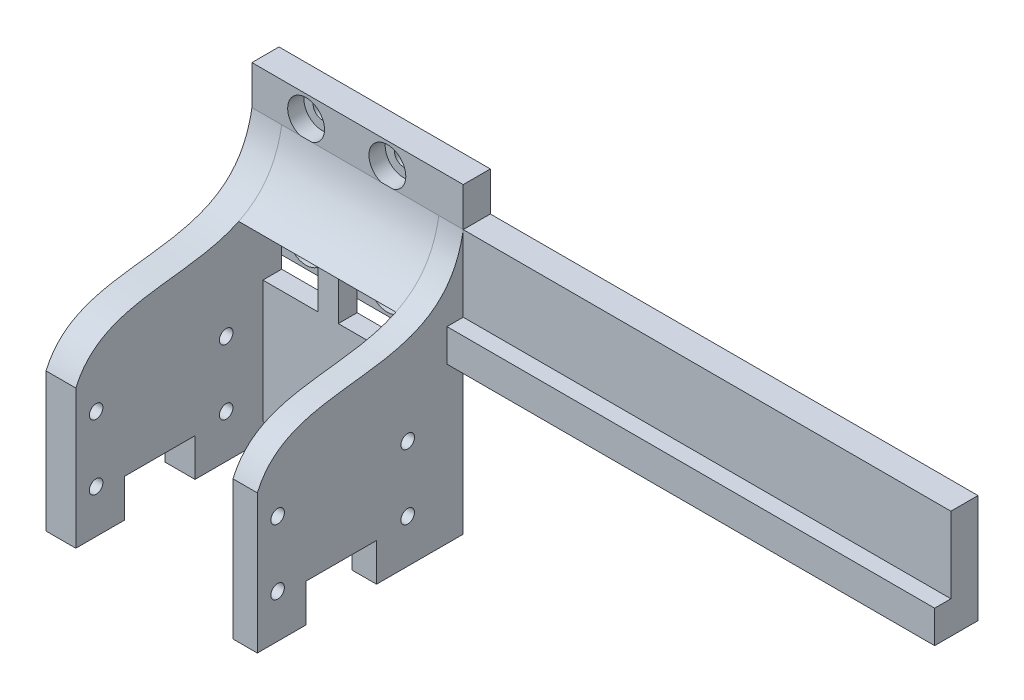
from build123d import *

# Parameters (mm, degrees)
BOSS_EXTRUDE1_DEPTH  = 5
SKETCH2_R            = 1.7
CUT_EXTRUDE1_DEPTH   = 5
SKETCH3_W            = 5.5
SKETCH3_H            = 45.88
SKETCH3_W_2          = 4.5
BOSS_EXTRUDE2_DEPTH  = 38
CUT_EXTRUDE2_REACH   = 149.725
SKETCH4_W            = 13
SKETCH4_H            = 7
SKETCH4_R            = 1.25
BOSS_EXTRUDE3_DEPTH  = 1
BOSS_EXTRUDE4_START  = -6
SKETCH7_W            = 90
SKETCH7_H            = 6
BOSS_EXTRUDE4_DEPTH  = 3
CUT_EXTRUDE4_START   = -7
CUT_EXTRUDE4_DEPTH   = 7
SKETCH9_R            = 3.4
CUT_EXTRUDE5_DEPTH   = 3
SKETCH10_W           = 4.789878221
SKETCH10_H           = 3.38
CUT_EXTRUDE8_DEPTH   = 1
SKETCH11_W           = 1.949149218
SKETCH11_H           = 7.867353861
CUT_EXTRUDE9_DEPTH   = 150
BOSS_EXTRUDE8_REACH  = 120.794
SKETCH12_W           = 3.475847807
SKETCH12_H           = 27.88
CUT_EXTRUDE10_REACH  = 149.725
SKETCH13_W           = 38
SKETCH13_H           = 20.273496977
BOSS_EXTRUDE9_DEPTH  = 5.5
BOSS_EXTRUDE10_START = -34.5
BOSS_EXTRUDE10_DEPTH = 4.5
BOSS_EXTRUDE11_REACH = 120.794
SKETCH16_W           = 3.200812403
SKETCH16_H           = 11.605139137
SKETCH16_W_2         = 3.702426982
SKETCH16_H_2         = 11.605139132
BOSS_EXTRUDE12_DEPTH = 3.475847807


with BuildPart() as part:
    # Sketch1 → Boss-Extrude1 (new body)
    with BuildSketch(Plane.XY):
        Polygon((-17.754674933, -9.049768579), (-17.754674933, -1.849768579), (-56.754674933, -1.849768579), (-56.754674933, -15.485645904), (-56.754674933, -29.849768579), (-17.754674933, -29.849768579), (-17.754674933, -29.049768579), (72.245325067, -29.049768579), (72.245325067, -9.049768579), align=None)
    extrude(amount=BOSS_EXTRUDE1_DEPTH)

    # Sketch2 → Cut-Extrude1 (cut)
    with BuildSketch(Plane.XY.offset(5)):
        with Locations((-46.754674933, -5.849768579)):
            Circle(SKETCH2_R)
        with Locations((-31.754674933, -5.849768579)):
            Circle(SKETCH2_R)
        with Locations((-31.754674933, -25.849768579)):
            Circle(SKETCH2_R)
        with Locations((-46.754674933, -25.849768579)):
            Circle(SKETCH2_R)
    extrude(amount=-CUT_EXTRUDE1_DEPTH, mode=Mode.SUBTRACT)

    # Sketch3 → Boss-Extrude2 (add)
    with BuildSketch(Plane.XY.offset(5)):
        with Locations((-54.004674933, -34.789768579)):
            Rectangle(SKETCH3_W, SKETCH3_H)
        with Locations((-20.004674933, -34.789768579)):
            Rectangle(SKETCH3_W_2, SKETCH3_H)
    extrude(amount=BOSS_EXTRUDE2_DEPTH)

    # Cut-Extrude2: up to this face of the body (flat: up to its plane)
    cut_extrude2_end = Plane(part.part.faces().sort_by_distance((-17.754674933, -34.777544983, 23.950785149))[0])
    # Sketch4 → Cut-Extrude2 (cut, up to the picked face)
    with BuildSketch(Plane.ZY.offset(56.754674933), mode=Mode.PRIVATE) as cut_extrude2_sk1:
        with Locations((27.5, -54.229768579)):
            Rectangle(SKETCH4_W, SKETCH4_H)
    cut_extrude2_tool1 = split(extrude(cut_extrude2_sk1.sketch, amount=-CUT_EXTRUDE2_REACH, mode=Mode.PRIVATE), bisect_by=cut_extrude2_end, keep=Keep.BOTH, mode=Mode.PRIVATE)
    # Sketch4 → Cut-Extrude2 (cut, up to the picked face)
    with BuildSketch(Plane.ZY.offset(56.754674933), mode=Mode.PRIVATE) as cut_extrude2_sk2:
        with Locations(Location((15.25, -37.729768579, 0), (0, 0, 270))):
            Circle(SKETCH4_R)
    cut_extrude2_tool2 = split(extrude(cut_extrude2_sk2.sketch, amount=-CUT_EXTRUDE2_REACH, mode=Mode.PRIVATE), bisect_by=cut_extrude2_end, keep=Keep.BOTH, mode=Mode.PRIVATE)
    # Sketch4 → Cut-Extrude2 (cut, up to the picked face)
    with BuildSketch(Plane.ZY.offset(56.754674933), mode=Mode.PRIVATE) as cut_extrude2_sk3:
        with Locations(Location((39.25, -37.729768579, 0), (0, 0, 270))):
            Circle(SKETCH4_R)
    cut_extrude2_tool3 = split(extrude(cut_extrude2_sk3.sketch, amount=-CUT_EXTRUDE2_REACH, mode=Mode.PRIVATE), bisect_by=cut_extrude2_end, keep=Keep.BOTH, mode=Mode.PRIVATE)
    # Sketch4 → Cut-Extrude2 (cut, up to the picked face)
    with BuildSketch(Plane.ZY.offset(56.754674933), mode=Mode.PRIVATE) as cut_extrude2_sk4:
        with Locations(Location((39.25, -49.729768579, 0), (0, 0, 270))):
            Circle(SKETCH4_R)
    cut_extrude2_tool4 = split(extrude(cut_extrude2_sk4.sketch, amount=-CUT_EXTRUDE2_REACH, mode=Mode.PRIVATE), bisect_by=cut_extrude2_end, keep=Keep.BOTH, mode=Mode.PRIVATE)
    # Sketch4 → Cut-Extrude2 (cut, up to the picked face)
    with BuildSketch(Plane.ZY.offset(56.754674933), mode=Mode.PRIVATE) as cut_extrude2_sk5:
        with Locations(Location((15.25, -49.729768579, 0), (0, 0, 270))):
            Circle(SKETCH4_R)
    cut_extrude2_tool5 = split(extrude(cut_extrude2_sk5.sketch, amount=-CUT_EXTRUDE2_REACH, mode=Mode.PRIVATE), bisect_by=cut_extrude2_end, keep=Keep.BOTH, mode=Mode.PRIVATE)
    add(cut_extrude2_tool1.solids().sort_by(Axis((-56.754675, -54.229769, 27.5), (1, 0, 0)))[0], mode=Mode.SUBTRACT)
    add(cut_extrude2_tool2.solids().sort_by(Axis((-56.754675, -37.729769, 15.25), (1, 0, 0)))[0], mode=Mode.SUBTRACT)
    add(cut_extrude2_tool3.solids().sort_by(Axis((-56.754675, -37.729769, 39.25), (1, 0, 0)))[0], mode=Mode.SUBTRACT)
    add(cut_extrude2_tool4.solids().sort_by(Axis((-56.754675, -49.729769, 39.25), (1, 0, 0)))[0], mode=Mode.SUBTRACT)
    add(cut_extrude2_tool5.solids().sort_by(Axis((-56.754675, -49.729769, 15.25), (1, 0, 0)))[0], mode=Mode.SUBTRACT)

    # Sketch5 → Boss-Extrude3 (add)
    with BuildSketch(Plane(origin=(0, 0, 0), x_dir=(-1, 0, 0), z_dir=(0, 0, -1))):
        with BuildLine():
            Line((-72.245325067, -26.669768579), (-71.800325067, -26.669768579))
            Line((-71.800325067, -26.669768579), (-70.984367777, -28.911592809))
            ThreePointArc((-70.984367777, -28.911592809), (-70.907483378, -29.011790508), (-70.787032326, -29.049768579))
            Line((-70.787032326, -29.049768579), (-70.377032326, -29.049768579))
            ThreePointArc((-70.377032326, -29.049768579), (-70.256581275, -29.011790508), (-70.179696876, -28.911592809))
            Line((-70.179696876, -28.911592809), (-69.363739586, -26.669768579))
            Line((-69.363739586, -26.669768579), (-68.473739586, -26.669768579))
            Line((-68.473739586, -26.669768579), (-67.657782296, -28.911592809))
            ThreePointArc((-67.657782296, -28.911592809), (-67.580897897, -29.011790508), (-67.460446845, -29.049768579))
            Line((-67.460446845, -29.049768579), (-67.050446845, -29.049768579))
            ThreePointArc((-67.050446845, -29.049768579), (-66.929995794, -29.011790508), (-66.853111395, -28.911592809))
            Line((-66.853111395, -28.911592809), (-66.037154105, -26.669768579))
            Line((-66.037154105, -26.669768579), (-65.140325067, -26.669768579))
            Line((-65.140325067, -26.669768579), (-64.324367777, -28.911592809))
            ThreePointArc((-64.324367777, -28.911592809), (-64.247483378, -29.011790508), (-64.127032326, -29.049768579))
            Line((-64.127032326, -29.049768579), (-63.717032326, -29.049768579))
            ThreePointArc((-63.717032326, -29.049768579), (-63.596581275, -29.011790508), (-63.519696876, -28.911592809))
            Line((-63.519696876, -28.911592809), (-62.703739586, -26.669768579))
            Line((-62.703739586, -26.669768579), (-61.813739586, -26.669768579))
            Line((-61.813739586, -26.669768579), (-60.997782296, -28.911592809))
            ThreePointArc((-60.997782296, -28.911592809), (-60.920897897, -29.011790508), (-60.800446845, -29.049768579))
            Line((-60.800446845, -29.049768579), (-60.390446845, -29.049768579))
            ThreePointArc((-60.390446845, -29.049768579), (-60.269995794, -29.011790508), (-60.193111395, -28.911592809))
            Line((-60.193111395, -28.911592809), (-59.377154105, -26.669768579))
            Line((-59.377154105, -26.669768579), (-58.480325067, -26.669768579))
            Line((-58.480325067, -26.669768579), (-57.664367777, -28.911592809))
            ThreePointArc((-57.664367777, -28.911592809), (-57.587483378, -29.011790508), (-57.467032326, -29.049768579))
            Line((-57.467032326, -29.049768579), (-57.057032326, -29.049768579))
            ThreePointArc((-57.057032326, -29.049768579), (-56.936581275, -29.011790508), (-56.859696876, -28.911592809))
            Line((-56.859696876, -28.911592809), (-56.043739586, -26.669768579))
            Line((-56.043739586, -26.669768579), (-55.153739586, -26.669768579))
            Line((-55.153739586, -26.669768579), (-54.337782296, -28.911592809))
            ThreePointArc((-54.337782296, -28.911592809), (-54.260897897, -29.011790508), (-54.140446845, -29.049768579))
            Line((-54.140446845, -29.049768579), (-53.730446845, -29.049768579))
            ThreePointArc((-53.730446845, -29.049768579), (-53.609995794, -29.011790508), (-53.533111395, -28.911592809))
            Line((-53.533111395, -28.911592809), (-52.717154105, -26.669768579))
            Line((-52.717154105, -26.669768579), (-51.820325067, -26.669768579))
            Line((-51.820325067, -26.669768579), (-51.004367777, -28.911592809))
            ThreePointArc((-51.004367777, -28.911592809), (-50.927483378, -29.011790508), (-50.807032326, -29.049768579))
            Line((-50.807032326, -29.049768579), (-50.397032326, -29.049768579))
            ThreePointArc((-50.397032326, -29.049768579), (-50.276581275, -29.011790508), (-50.199696876, -28.911592809))
            Line((-50.199696876, -28.911592809), (-49.383739586, -26.669768579))
            Line((-49.383739586, -26.669768579), (-48.493739586, -26.669768579))
            Line((-48.493739586, -26.669768579), (-47.677782296, -28.911592809))
            ThreePointArc((-47.677782296, -28.911592809), (-47.600897897, -29.011790508), (-47.480446845, -29.049768579))
            Line((-47.480446845, -29.049768579), (-47.070446845, -29.049768579))
            ThreePointArc((-47.070446845, -29.049768579), (-46.949995794, -29.011790508), (-46.873111395, -28.911592809))
            Line((-46.873111395, -28.911592809), (-46.057154105, -26.669768579))
            Line((-46.057154105, -26.669768579), (-45.160325067, -26.669768579))
            Line((-45.160325067, -26.669768579), (-44.344367777, -28.911592809))
            ThreePointArc((-44.344367777, -28.911592809), (-44.267483378, -29.011790508), (-44.147032326, -29.049768579))
            Line((-44.147032326, -29.049768579), (-43.737032326, -29.049768579))
            ThreePointArc((-43.737032326, -29.049768579), (-43.616581275, -29.011790508), (-43.539696876, -28.911592809))
            Line((-43.539696876, -28.911592809), (-42.723739586, -26.669768579))
            Line((-42.723739586, -26.669768579), (-41.833739586, -26.669768579))
            Line((-41.833739586, -26.669768579), (-41.017782296, -28.911592809))
            ThreePointArc((-41.017782296, -28.911592809), (-40.940897897, -29.011790508), (-40.820446845, -29.049768579))
            Line((-40.820446845, -29.049768579), (-40.410446845, -29.049768579))
            ThreePointArc((-40.410446845, -29.049768579), (-40.289995794, -29.011790508), (-40.213111395, -28.911592809))
            Line((-40.213111395, -28.911592809), (-39.397154105, -26.669768579))
            Line((-39.397154105, -26.669768579), (-38.500325067, -26.669768579))
            Line((-38.500325067, -26.669768579), (-37.684367777, -28.911592809))
            ThreePointArc((-37.684367777, -28.911592809), (-37.607483378, -29.011790508), (-37.487032326, -29.049768579))
            Line((-37.487032326, -29.049768579), (-37.077032326, -29.049768579))
            ThreePointArc((-37.077032326, -29.049768579), (-36.956581275, -29.011790508), (-36.879696876, -28.911592809))
            Line((-36.879696876, -28.911592809), (-36.063739586, -26.669768579))
            Line((-36.063739586, -26.669768579), (-35.173739586, -26.669768579))
            Line((-35.173739586, -26.669768579), (-34.357782296, -28.911592809))
            ThreePointArc((-34.357782296, -28.911592809), (-34.280897897, -29.011790508), (-34.160446845, -29.049768579))
            Line((-34.160446845, -29.049768579), (-33.750446845, -29.049768579))
            ThreePointArc((-33.750446845, -29.049768579), (-33.629995794, -29.011790508), (-33.553111395, -28.911592809))
            Line((-33.553111395, -28.911592809), (-32.737154105, -26.669768579))
            Line((-32.737154105, -26.669768579), (-31.840325067, -26.669768579))
            Line((-31.840325067, -26.669768579), (-31.024367777, -28.911592809))
            ThreePointArc((-31.024367777, -28.911592809), (-30.947483378, -29.011790508), (-30.827032326, -29.049768579))
            Line((-30.827032326, -29.049768579), (-30.417032326, -29.049768579))
            ThreePointArc((-30.417032326, -29.049768579), (-30.296581275, -29.011790508), (-30.219696876, -28.911592809))
            Line((-30.219696876, -28.911592809), (-29.403739586, -26.669768579))
            Line((-29.403739586, -26.669768579), (-28.513739586, -26.669768579))
            Line((-28.513739586, -26.669768579), (-27.697782296, -28.911592809))
            ThreePointArc((-27.697782296, -28.911592809), (-27.620897897, -29.011790508), (-27.500446845, -29.049768579))
            Line((-27.500446845, -29.049768579), (-27.090446845, -29.049768579))
            ThreePointArc((-27.090446845, -29.049768579), (-26.969995794, -29.011790508), (-26.893111395, -28.911592809))
            Line((-26.893111395, -28.911592809), (-26.077154105, -26.669768579))
            Line((-26.077154105, -26.669768579), (-25.180325067, -26.669768579))
            Line((-25.180325067, -26.669768579), (-24.364367777, -28.911592809))
            ThreePointArc((-24.364367777, -28.911592809), (-24.287483378, -29.011790508), (-24.167032326, -29.049768579))
            Line((-24.167032326, -29.049768579), (-23.757032326, -29.049768579))
            ThreePointArc((-23.757032326, -29.049768579), (-23.636581275, -29.011790508), (-23.559696876, -28.911592809))
            Line((-23.559696876, -28.911592809), (-22.743739586, -26.669768579))
            Line((-22.743739586, -26.669768579), (-21.853739586, -26.669768579))
            Line((-21.853739586, -26.669768579), (-21.037782296, -28.911592809))
            ThreePointArc((-21.037782296, -28.911592809), (-20.960897897, -29.011790508), (-20.840446845, -29.049768579))
            Line((-20.840446845, -29.049768579), (-20.430446845, -29.049768579))
            ThreePointArc((-20.430446845, -29.049768579), (-20.309995794, -29.011790508), (-20.233111395, -28.911592809))
            Line((-20.233111395, -28.911592809), (-19.417154105, -26.669768579))
            Line((-19.417154105, -26.669768579), (-18.520325067, -26.669768579))
            Line((-18.520325067, -26.669768579), (-17.704367777, -28.911592809))
            ThreePointArc((-17.704367777, -28.911592809), (-17.627483378, -29.011790508), (-17.507032326, -29.049768579))
            Line((-17.507032326, -29.049768579), (-17.097032326, -29.049768579))
            ThreePointArc((-17.097032326, -29.049768579), (-16.976581275, -29.011790508), (-16.899696876, -28.911592809))
            Line((-16.899696876, -28.911592809), (-16.083739586, -26.669768579))
            Line((-16.083739586, -26.669768579), (-15.193739586, -26.669768579))
            Line((-15.193739586, -26.669768579), (-14.377782296, -28.911592809))
            ThreePointArc((-14.377782296, -28.911592809), (-14.300897897, -29.011790508), (-14.180446845, -29.049768579))
            Line((-14.180446845, -29.049768579), (-13.770446845, -29.049768579))
            ThreePointArc((-13.770446845, -29.049768579), (-13.649995794, -29.011790508), (-13.573111395, -28.911592809))
            Line((-13.573111395, -28.911592809), (-12.757154105, -26.669768579))
            Line((-12.757154105, -26.669768579), (-11.860325067, -26.669768579))
            Line((-11.860325067, -26.669768579), (-11.044367777, -28.911592809))
            ThreePointArc((-11.044367777, -28.911592809), (-10.967483378, -29.011790508), (-10.847032326, -29.049768579))
            Line((-10.847032326, -29.049768579), (-10.437032326, -29.049768579))
            ThreePointArc((-10.437032326, -29.049768579), (-10.316581275, -29.011790508), (-10.239696876, -28.911592809))
            Line((-10.239696876, -28.911592809), (-9.423739586, -26.669768579))
            Line((-9.423739586, -26.669768579), (-8.533739586, -26.669768579))
            Line((-8.533739586, -26.669768579), (-7.717782296, -28.911592809))
            ThreePointArc((-7.717782296, -28.911592809), (-7.640897897, -29.011790508), (-7.520446845, -29.049768579))
            Line((-7.520446845, -29.049768579), (-7.110446845, -29.049768579))
            ThreePointArc((-7.110446845, -29.049768579), (-6.989995794, -29.011790508), (-6.913111395, -28.911592809))
            Line((-6.913111395, -28.911592809), (-6.097154105, -26.669768579))
            Line((-6.097154105, -26.669768579), (-5.647154105, -26.669768579))
            Line((-5.647154105, -26.669768579), (-5.647154105, -25.669768579))
            Line((-5.647154105, -25.669768579), (-72.245325067, -25.669768579))
            Line((-72.245325067, -25.669768579), (-72.245325067, -26.669768579))
        make_face()
    extrude(amount=BOSS_EXTRUDE3_DEPTH)

    # Sketch7 → Boss-Extrude4 (add)
    with BuildSketch(Plane(origin=(0, 0, -1), x_dir=(-1, 0, 0), z_dir=(0, 0, -1)).offset(BOSS_EXTRUDE4_START)):
        with Locations((-27.245325067, -26.049768579)):
            Rectangle(SKETCH7_W, SKETCH7_H)
    extrude(amount=-BOSS_EXTRUDE4_DEPTH)

    # Sketch8 → Cut-Extrude4 (cut)
    with BuildSketch(Plane(origin=(0, 0, -1), x_dir=(-1, 0, 0), z_dir=(0, 0, -1)).offset(CUT_EXTRUDE4_START)):
        with BuildLine():
            ThreePointArc((-7.717782296, -28.911592809), (-7.640897897, -29.011790508), (-7.520446845, -29.049768579))
            Line((-7.520446845, -29.049768579), (-10.437032326, -29.049768579))
            ThreePointArc((-10.437032326, -29.049768579), (-10.316581275, -29.011790508), (-10.239696876, -28.911592809))
            Line((-10.239696876, -28.911592809), (-9.423739586, -26.669768579))
            Line((-9.423739586, -26.669768579), (-8.533739586, -26.669768579))
            Line((-8.533739586, -26.669768579), (-7.717782296, -28.911592809))
        make_face()
        with BuildLine():
            ThreePointArc((-4.387782296, -28.911592809), (-4.310897897, -29.011790508), (-4.190446845, -29.049768579))
            Line((-4.190446845, -29.049768579), (-7.107032326, -29.049768579))
            ThreePointArc((-7.107032326, -29.049768579), (-6.986581275, -29.011790508), (-6.909696876, -28.911592809))
            Line((-6.909696876, -28.911592809), (-6.093739586, -26.669768579))
            Line((-6.093739586, -26.669768579), (-5.203739586, -26.669768579))
            Line((-5.203739586, -26.669768579), (-4.387782296, -28.911592809))
        make_face()
        with BuildLine():
            ThreePointArc((-1.057782296, -28.911592809), (-0.980897897, -29.011790508), (-0.860446845, -29.049768579))
            Line((-0.860446845, -29.049768579), (-3.777032326, -29.049768579))
            ThreePointArc((-3.777032326, -29.049768579), (-3.656581275, -29.011790508), (-3.579696876, -28.911592809))
            Line((-3.579696876, -28.911592809), (-2.763739586, -26.669768579))
            Line((-2.763739586, -26.669768579), (-1.873739586, -26.669768579))
            Line((-1.873739586, -26.669768579), (-1.057782296, -28.911592809))
        make_face()
        with BuildLine():
            ThreePointArc((2.272217704, -28.911592809), (2.349102103, -29.011790508), (2.469553155, -29.049768579))
            Line((2.469553155, -29.049768579), (-0.447032326, -29.049768579))
            ThreePointArc((-0.447032326, -29.049768579), (-0.326581275, -29.011790508), (-0.249696876, -28.911592809))
            Line((-0.249696876, -28.911592809), (0.566260414, -26.669768579))
            Line((0.566260414, -26.669768579), (1.456260414, -26.669768579))
            Line((1.456260414, -26.669768579), (2.272217704, -28.911592809))
        make_face()
        with BuildLine():
            ThreePointArc((5.602217704, -28.911592809), (5.679102103, -29.011790508), (5.799553155, -29.049768579))
            Line((5.799553155, -29.049768579), (2.882967674, -29.049768579))
            ThreePointArc((2.882967674, -29.049768579), (3.003418725, -29.011790508), (3.080303124, -28.911592809))
            Line((3.080303124, -28.911592809), (3.896260414, -26.669768579))
            Line((3.896260414, -26.669768579), (4.786260414, -26.669768579))
            Line((4.786260414, -26.669768579), (5.602217704, -28.911592809))
        make_face()
        with BuildLine():
            ThreePointArc((8.932217704, -28.911592809), (9.009102103, -29.011790508), (9.129553155, -29.049768579))
            Line((9.129553155, -29.049768579), (6.212967674, -29.049768579))
            ThreePointArc((6.212967674, -29.049768579), (6.333418725, -29.011790508), (6.410303124, -28.911592809))
            Line((6.410303124, -28.911592809), (7.226260414, -26.669768579))
            Line((7.226260414, -26.669768579), (8.116260414, -26.669768579))
            Line((8.116260414, -26.669768579), (8.932217704, -28.911592809))
        make_face()
        with BuildLine():
            ThreePointArc((12.262217704, -28.911592809), (12.339102103, -29.011790508), (12.459553155, -29.049768579))
            Line((12.459553155, -29.049768579), (9.542967674, -29.049768579))
            ThreePointArc((9.542967674, -29.049768579), (9.663418725, -29.011790508), (9.740303124, -28.911592809))
            Line((9.740303124, -28.911592809), (10.556260414, -26.669768579))
            Line((10.556260414, -26.669768579), (11.446260414, -26.669768579))
            Line((11.446260414, -26.669768579), (12.262217704, -28.911592809))
        make_face()
        with BuildLine():
            ThreePointArc((15.592217704, -28.911592809), (15.669102103, -29.011790508), (15.789553155, -29.049768579))
            Line((15.789553155, -29.049768579), (12.872967674, -29.049768579))
            ThreePointArc((12.872967674, -29.049768579), (12.993418725, -29.011790508), (13.070303124, -28.911592809))
            Line((13.070303124, -28.911592809), (13.886260414, -26.669768579))
            Line((13.886260414, -26.669768579), (14.776260414, -26.669768579))
            Line((14.776260414, -26.669768579), (15.592217704, -28.911592809))
        make_face()
        with BuildLine():
            ThreePointArc((-63.717032326, -29.049768579), (-63.596581275, -29.011790508), (-63.519696876, -28.911592809))
            Line((-63.519696876, -28.911592809), (-62.703739586, -26.669768579))
            Line((-62.703739586, -26.669768579), (-61.813739586, -26.669768579))
            Line((-61.813739586, -26.669768579), (-60.997782296, -28.911592809))
            ThreePointArc((-60.997782296, -28.911592809), (-60.920897897, -29.011790508), (-60.800446845, -29.049768579))
            Line((-60.800446845, -29.049768579), (-63.717032326, -29.049768579))
        make_face()
        with BuildLine():
            ThreePointArc((-60.390446845, -29.049768579), (-60.269995794, -29.011790508), (-60.193111395, -28.911592809))
            Line((-60.193111395, -28.911592809), (-59.377154105, -26.669768579))
            Line((-59.377154105, -26.669768579), (-58.480325067, -26.669768579))
            Line((-58.480325067, -26.669768579), (-57.664367777, -28.911592809))
            ThreePointArc((-57.664367777, -28.911592809), (-57.587483378, -29.011790508), (-57.467032326, -29.049768579))
            Line((-57.467032326, -29.049768579), (-60.390446845, -29.049768579))
        make_face()
        with BuildLine():
            ThreePointArc((-57.057032326, -29.049768579), (-56.936581275, -29.011790508), (-56.859696876, -28.911592809))
            Line((-56.859696876, -28.911592809), (-56.043739586, -26.669768579))
            Line((-56.043739586, -26.669768579), (-55.153739586, -26.669768579))
            Line((-55.153739586, -26.669768579), (-54.337782296, -28.911592809))
            ThreePointArc((-54.337782296, -28.911592809), (-54.260897897, -29.011790508), (-54.140446845, -29.049768579))
            Line((-54.140446845, -29.049768579), (-57.057032326, -29.049768579))
        make_face()
        with BuildLine():
            ThreePointArc((-50.397032326, -29.049768579), (-50.276581275, -29.011790508), (-50.199696876, -28.911592809))
            Line((-50.199696876, -28.911592809), (-49.383739586, -26.669768579))
            Line((-49.383739586, -26.669768579), (-48.493739586, -26.669768579))
            Line((-48.493739586, -26.669768579), (-47.677782296, -28.911592809))
            ThreePointArc((-47.677782296, -28.911592809), (-47.600897897, -29.011790508), (-47.480446845, -29.049768579))
            Line((-47.480446845, -29.049768579), (-50.397032326, -29.049768579))
        make_face()
        with BuildLine():
            ThreePointArc((-53.730446845, -29.049768579), (-53.609995794, -29.011790508), (-53.533111395, -28.911592809))
            Line((-53.533111395, -28.911592809), (-52.717154105, -26.669768579))
            Line((-52.717154105, -26.669768579), (-51.820325067, -26.669768579))
            Line((-51.820325067, -26.669768579), (-51.004367777, -28.911592809))
            ThreePointArc((-51.004367777, -28.911592809), (-50.927483378, -29.011790508), (-50.807032326, -29.049768579))
            Line((-50.807032326, -29.049768579), (-53.730446845, -29.049768579))
        make_face()
        with BuildLine():
            ThreePointArc((-47.070446845, -29.049768579), (-46.949995794, -29.011790508), (-46.873111395, -28.911592809))
            Line((-46.873111395, -28.911592809), (-46.057154105, -26.669768579))
            Line((-46.057154105, -26.669768579), (-45.160325067, -26.669768579))
            Line((-45.160325067, -26.669768579), (-44.344367777, -28.911592809))
            ThreePointArc((-44.344367777, -28.911592809), (-44.267483378, -29.011790508), (-44.147032326, -29.049768579))
            Line((-44.147032326, -29.049768579), (-47.070446845, -29.049768579))
        make_face()
        with BuildLine():
            ThreePointArc((-43.737032326, -29.049768579), (-43.616581275, -29.011790508), (-43.539696876, -28.911592809))
            Line((-43.539696876, -28.911592809), (-42.723739586, -26.669768579))
            Line((-42.723739586, -26.669768579), (-41.833739586, -26.669768579))
            Line((-41.833739586, -26.669768579), (-41.017782296, -28.911592809))
            ThreePointArc((-41.017782296, -28.911592809), (-40.940897897, -29.011790508), (-40.820446845, -29.049768579))
            Line((-40.820446845, -29.049768579), (-43.737032326, -29.049768579))
        make_face()
        with BuildLine():
            ThreePointArc((-40.410446845, -29.049768579), (-40.289995794, -29.011790508), (-40.213111395, -28.911592809))
            Line((-40.213111395, -28.911592809), (-39.397154105, -26.669768579))
            Line((-39.397154105, -26.669768579), (-38.500325067, -26.669768579))
            Line((-38.500325067, -26.669768579), (-37.684367777, -28.911592809))
            ThreePointArc((-37.684367777, -28.911592809), (-37.607483378, -29.011790508), (-37.487032326, -29.049768579))
            Line((-37.487032326, -29.049768579), (-40.410446845, -29.049768579))
        make_face()
        with BuildLine():
            ThreePointArc((-37.077032326, -29.049768579), (-36.956581275, -29.011790508), (-36.879696876, -28.911592809))
            Line((-36.879696876, -28.911592809), (-36.063739586, -26.669768579))
            Line((-36.063739586, -26.669768579), (-35.173739586, -26.669768579))
            Line((-35.173739586, -26.669768579), (-34.357782296, -28.911592809))
            ThreePointArc((-34.357782296, -28.911592809), (-34.280897897, -29.011790508), (-34.160446845, -29.049768579))
            Line((-34.160446845, -29.049768579), (-37.077032326, -29.049768579))
        make_face()
        with BuildLine():
            ThreePointArc((-33.750446845, -29.049768579), (-33.629995794, -29.011790508), (-33.553111395, -28.911592809))
            Line((-33.553111395, -28.911592809), (-32.737154105, -26.669768579))
            Line((-32.737154105, -26.669768579), (-31.840325067, -26.669768579))
            Line((-31.840325067, -26.669768579), (-31.024367777, -28.911592809))
            ThreePointArc((-31.024367777, -28.911592809), (-30.947483378, -29.011790508), (-30.827032326, -29.049768579))
            Line((-30.827032326, -29.049768579), (-33.750446845, -29.049768579))
        make_face()
        with BuildLine():
            ThreePointArc((-30.417032326, -29.049768579), (-30.296581275, -29.011790508), (-30.219696876, -28.911592809))
            Line((-30.219696876, -28.911592809), (-29.403739586, -26.669768579))
            Line((-29.403739586, -26.669768579), (-28.513739586, -26.669768579))
            Line((-28.513739586, -26.669768579), (-27.697782296, -28.911592809))
            ThreePointArc((-27.697782296, -28.911592809), (-27.620897897, -29.011790508), (-27.500446845, -29.049768579))
            Line((-27.500446845, -29.049768579), (-30.417032326, -29.049768579))
        make_face()
        with BuildLine():
            ThreePointArc((-27.090446845, -29.049768579), (-26.969995794, -29.011790508), (-26.893111395, -28.911592809))
            Line((-26.893111395, -28.911592809), (-26.077154105, -26.669768579))
            Line((-26.077154105, -26.669768579), (-25.180325067, -26.669768579))
            Line((-25.180325067, -26.669768579), (-24.364367777, -28.911592809))
            ThreePointArc((-24.364367777, -28.911592809), (-24.287483378, -29.011790508), (-24.167032326, -29.049768579))
            Line((-24.167032326, -29.049768579), (-27.090446845, -29.049768579))
        make_face()
        with BuildLine():
            ThreePointArc((-23.757032326, -29.049768579), (-23.636581275, -29.011790508), (-23.559696876, -28.911592809))
            Line((-23.559696876, -28.911592809), (-22.743739586, -26.669768579))
            Line((-22.743739586, -26.669768579), (-21.853739586, -26.669768579))
            Line((-21.853739586, -26.669768579), (-21.037782296, -28.911592809))
            ThreePointArc((-21.037782296, -28.911592809), (-20.960897897, -29.011790508), (-20.840446845, -29.049768579))
            Line((-20.840446845, -29.049768579), (-23.757032326, -29.049768579))
        make_face()
        with BuildLine():
            ThreePointArc((-20.430446845, -29.049768579), (-20.309995794, -29.011790508), (-20.233111395, -28.911592809))
            Line((-20.233111395, -28.911592809), (-19.417154105, -26.669768579))
            Line((-19.417154105, -26.669768579), (-18.520325067, -26.669768579))
            Line((-18.520325067, -26.669768579), (-17.704367777, -28.911592809))
            ThreePointArc((-17.704367777, -28.911592809), (-17.627483378, -29.011790508), (-17.507032326, -29.049768579))
            Line((-17.507032326, -29.049768579), (-20.430446845, -29.049768579))
        make_face()
        with BuildLine():
            ThreePointArc((-17.097032326, -29.049768579), (-16.976581275, -29.011790508), (-16.899696876, -28.911592809))
            Line((-16.899696876, -28.911592809), (-16.083739586, -26.669768579))
            Line((-16.083739586, -26.669768579), (-15.193739586, -26.669768579))
            Line((-15.193739586, -26.669768579), (-14.377782296, -28.911592809))
            ThreePointArc((-14.377782296, -28.911592809), (-14.300897897, -29.011790508), (-14.180446845, -29.049768579))
            Line((-14.180446845, -29.049768579), (-17.097032326, -29.049768579))
        make_face()
        with BuildLine():
            ThreePointArc((-13.770446845, -29.049768579), (-13.649995794, -29.011790508), (-13.573111395, -28.911592809))
            Line((-13.573111395, -28.911592809), (-12.757154105, -26.669768579))
            Line((-12.757154105, -26.669768579), (-11.860325067, -26.669768579))
            Line((-11.860325067, -26.669768579), (-11.044367777, -28.911592809))
            ThreePointArc((-11.044367777, -28.911592809), (-10.967483378, -29.011790508), (-10.847032326, -29.049768579))
            Line((-10.847032326, -29.049768579), (-13.770446845, -29.049768579))
        make_face()
    extrude(amount=CUT_EXTRUDE4_DEPTH, mode=Mode.SUBTRACT)

    # Sketch9 → Cut-Extrude5 (cut)
    with BuildSketch(Plane.XY.offset(5)):
        with Locations((-46.754674933, -5.849768579)):
            Circle(SKETCH9_R)
        with Locations((-31.754674933, -5.849768579)):
            Circle(SKETCH9_R)
        with Locations((-31.754674933, -25.849768579)):
            Circle(SKETCH9_R)
        with Locations((-46.754674933, -25.849768579)):
            Circle(SKETCH9_R)
    extrude(amount=-CUT_EXTRUDE5_DEPTH, mode=Mode.SUBTRACT)

    # Sketch10 → Cut-Extrude8 (cut)
    with BuildSketch(Plane(origin=(0, 0, -1), x_dir=(-1, 0, 0), z_dir=(0, 0, -1))):
        with Locations((-8.042093215, -27.359768579)):
            Rectangle(SKETCH10_W, SKETCH10_H)
    extrude(amount=-CUT_EXTRUDE8_DEPTH, mode=Mode.SUBTRACT)

    # Sketch11 → Cut-Extrude9 (cut)
    with BuildSketch(Plane(origin=(72.245325067, 0, 0), x_dir=(0, 0, -1), z_dir=(1, 0, 0))):
        with Locations((0.974574609, -26.433113521)):
            Rectangle(SKETCH11_W, SKETCH11_H)
    extrude(amount=-CUT_EXTRUDE9_DEPTH, mode=Mode.SUBTRACT)

    # Boss-Extrude8: up to this face of the body (flat: up to its plane)
    boss_extrude8_end = Plane(part.part.faces().sort_by_distance((-51.254674933, -33.598826345, 23.765854716))[0])
    # Sketch12 → Boss-Extrude8 (add, up to the picked face)
    with BuildSketch(Plane.ZY.offset(22.254674933), mode=Mode.PRIVATE) as boss_extrude8_sk1:
        with Locations((6.737923904, -40.789768579)):
            Rectangle(SKETCH12_W, SKETCH12_H)
    boss_extrude8_tool1 = split(extrude(boss_extrude8_sk1.sketch, amount=BOSS_EXTRUDE8_REACH, mode=Mode.PRIVATE), bisect_by=boss_extrude8_end, keep=Keep.BOTH, mode=Mode.PRIVATE)
    add(boss_extrude8_tool1.solids().sort_by(Axis((-22.254675, -40.789769, 6.737924), (-1, 0, 0)))[0])

    # Cut-Extrude10: up to this face of the body (flat: up to its plane)
    cut_extrude10_end = Plane(part.part.faces().sort_by_distance((-17.754674933, -33.672514532, 23.905292116))[0])
    # Sketch13 → Cut-Extrude10 (cut, up to the picked face)
    with BuildSketch(Plane.ZY.offset(56.754674933), mode=Mode.PRIVATE) as cut_extrude10_sk1:
        with Locations((24, -21.986517067)):
            Rectangle(SKETCH13_W, SKETCH13_H)
    cut_extrude10_tool1 = split(extrude(cut_extrude10_sk1.sketch, amount=-CUT_EXTRUDE10_REACH, mode=Mode.PRIVATE), bisect_by=cut_extrude10_end, keep=Keep.BOTH, mode=Mode.PRIVATE)
    add(cut_extrude10_tool1.solids().sort_by(Axis((-56.754675, -21.986517, 24), (1, 0, 0)))[0], mode=Mode.SUBTRACT)


with BuildPart() as cut_extrude10_piece_1:
    # of the separate pieces the step leaves, piece 1, a body of its own (cut_extrude10_pieces)
    add(part.part.solids().sort_by_distance((-17.754674933, -9.049768579, 0))[0])



with BuildPart() as cut_extrude10_piece_2:
    # of the separate pieces the step leaves, piece 2, a body of its own (cut_extrude10_pieces)
    add(part.part.solids().sort_by_distance((-17.754674933, -32.123265556, 43))[0])


with BuildPart() as cut_extrude10_piece_1_1:
    add(cut_extrude10_piece_1.part)

    add(cut_extrude10_piece_2.part)  # Boss-Extrude9 merges Cut-Extrude10 piece 2
    # Sketch14 → Boss-Extrude9 (add)
    with BuildSketch(Plane.ZY.offset(56.754674933)):
        with BuildLine():
            Line((5, -9.049768579), (5, -32.123265556))
            Line((5, -32.123265556), (43, -32.123265556))
            add(Edge.make_bspline(
                [(5, -9.049768579), (8.651220632, -31.009061287), (36.269346656, -16.687437831), (43, -32.123265556)],
                knots=[0, 0, 0, 0, 1, 1, 1, 1], degree=3))
        make_face()
    extrude(amount=-BOSS_EXTRUDE9_DEPTH)

    # Sketch14<2> → Boss-Extrude10 (add)
    with BuildSketch(Plane.ZY.offset(56.754674933).offset(BOSS_EXTRUDE10_START)):
        with BuildLine():
            Line((5, -9.049768579), (5, -32.123265556))
            Line((5, -32.123265556), (43, -32.123265556))
            add(Edge.make_bspline(
                [(5, -9.049768579), (8.651220632, -31.009061287), (36.269346656, -16.687437831), (43, -32.123265556)],
                knots=[0, 0, 0, 0, 1, 1, 1, 1], degree=3))
        make_face()
    extrude(amount=-BOSS_EXTRUDE10_DEPTH)

    # Boss-Extrude11: up to this face of the body (flat: up to its plane)
    boss_extrude11_end = Plane(cut_extrude10_piece_1_1.part.faces().sort_by_distance((-51.254674933, -38.582568604, 23.520202997))[0])
    # Sketch15 → Boss-Extrude11 (add, up to the picked face)
    with BuildSketch(Plane.ZY.offset(22.254674933), mode=Mode.PRIVATE) as boss_extrude11_sk1:
        with BuildLine():
            Line((5, -9.049768579), (5, -20.518126419))
            Line((5, -20.518126419), (12.934266813, -20.518126419))
            add(Edge.make_bspline(
                [(12.934266813, -20.518126419), (9.033366434, -18.625694897), (6.041548352, -15.313883361), (5, -9.049768579)],
                knots=[0.714739684, 0.714739684, 0.714739684, 0.714739684, 1, 1, 1, 1], degree=3))
        make_face()
    boss_extrude11_tool1 = split(extrude(boss_extrude11_sk1.sketch, amount=BOSS_EXTRUDE11_REACH, mode=Mode.PRIVATE), bisect_by=boss_extrude11_end, keep=Keep.BOTH, mode=Mode.PRIVATE)
    add(boss_extrude11_tool1.solids().sort_by(Axis((-22.254675, -17.515239, 7.17426), (-1, 0, 0)))[0])

    # Sketch16 → Boss-Extrude12 (add)
    with BuildSketch(Plane.XY.offset(5)):
        with Locations((-23.855081135, -26.320695988)):
            Rectangle(SKETCH16_W, SKETCH16_H)
        with Locations((-39.193440082, -26.32069599)):
            Rectangle(SKETCH16_W_2, SKETCH16_H_2)
    extrude(amount=BOSS_EXTRUDE12_DEPTH)


solid = cut_extrude10_piece_1_1.part
